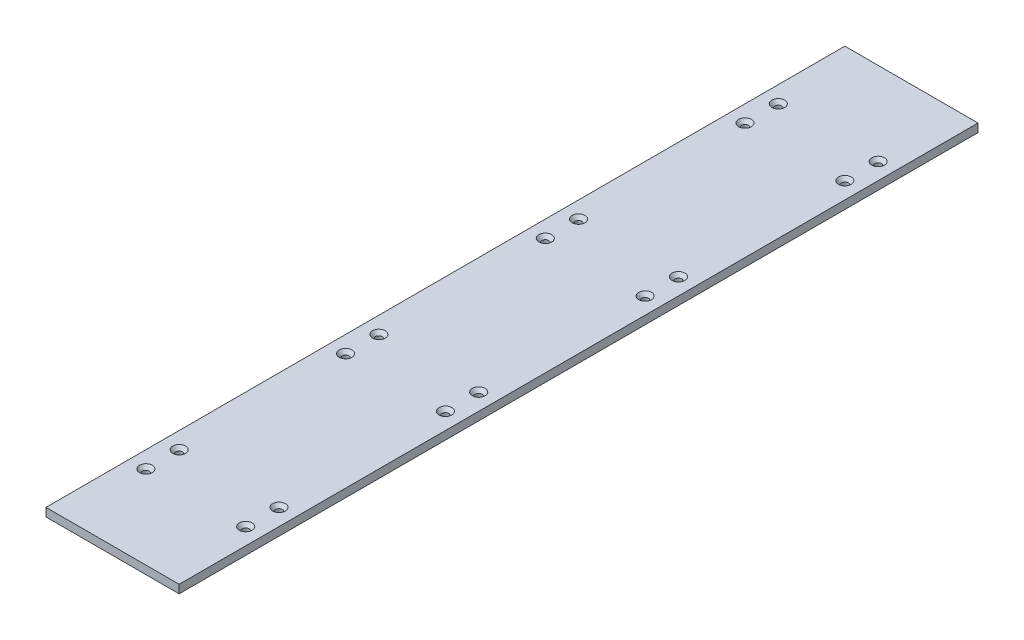
from build123d import *

# Parameters (mm, degrees)
SKETCH1_W                                       = 101.6
SKETCH1_H                                       = 609.6
BOSS_EXTRUDE1_DEPTH                             = 3.175
CSK_FOR_10_FLAT_HEAD_MACHINE_SCREW1_D           = 5.1054
CSK_FOR_10_FLAT_HEAD_MACHINE_SCREW1_CSINK_D     = 9.779
CSK_FOR_10_FLAT_HEAD_MACHINE_SCREW1_CSINK_ANGLE = 82
MIRROR4_COPY_1_D                                = 5.1054
MIRROR4_COPY_1_CSINK_D                          = 9.779
MIRROR4_COPY_1_CSINK_ANGLE                      = 82


with BuildPart() as part:
    # Sketch1 → Boss-Extrude1 (new, symmetric)
    with BuildSketch(Plane(origin=(0, 0, 0), x_dir=(1, 0, 0), z_dir=(0, 1, 0))):
        Rectangle(SKETCH1_W, SKETCH1_H)
    extrude(amount=BOSS_EXTRUDE1_DEPTH, both=True)

    # CSK for #10 Flat Head Machine Screw1 (through all)
    with Locations(Plane(origin=(0, 3.175, 0), x_dir=(1, 0, 0), z_dir=(0, 1, 0))):
        with Locations((-38.1, -88.9), (-38.1, -63.5), (-38.1, -215.9), (-38.1, -241.3)):
            csk_for_10_flat_head_machine_screw1 = CounterSinkHole(CSK_FOR_10_FLAT_HEAD_MACHINE_SCREW1_D / 2, CSK_FOR_10_FLAT_HEAD_MACHINE_SCREW1_CSINK_D / 2, counter_sink_angle=CSK_FOR_10_FLAT_HEAD_MACHINE_SCREW1_CSINK_ANGLE)

    # Mirror3: CSK for #10 Flat Head Machine Screw1 across plane
    add(csk_for_10_flat_head_machine_screw1.mirror(Plane.XY), mode=Mode.SUBTRACT)

    # Mirror4: CSK for #10 Flat Head Machine Screw1 across plane
    add(csk_for_10_flat_head_machine_screw1.mirror(Plane(origin=(0, 0, 0), x_dir=(0, 0, 1), z_dir=(1, 0, 0))), mode=Mode.SUBTRACT)

    # Mirror4 copy 1 (through all)
    with Locations(Plane(origin=(0, 3.175, 0), x_dir=(-1, 0, 0), z_dir=(0, 1, 0))):
        with Locations((-38.1, -88.9), (-38.1, -63.5), (-38.1, -215.9), (-38.1, -241.3)):
            CounterSinkHole(MIRROR4_COPY_1_D / 2, MIRROR4_COPY_1_CSINK_D / 2, counter_sink_angle=MIRROR4_COPY_1_CSINK_ANGLE)


solid = part.part
